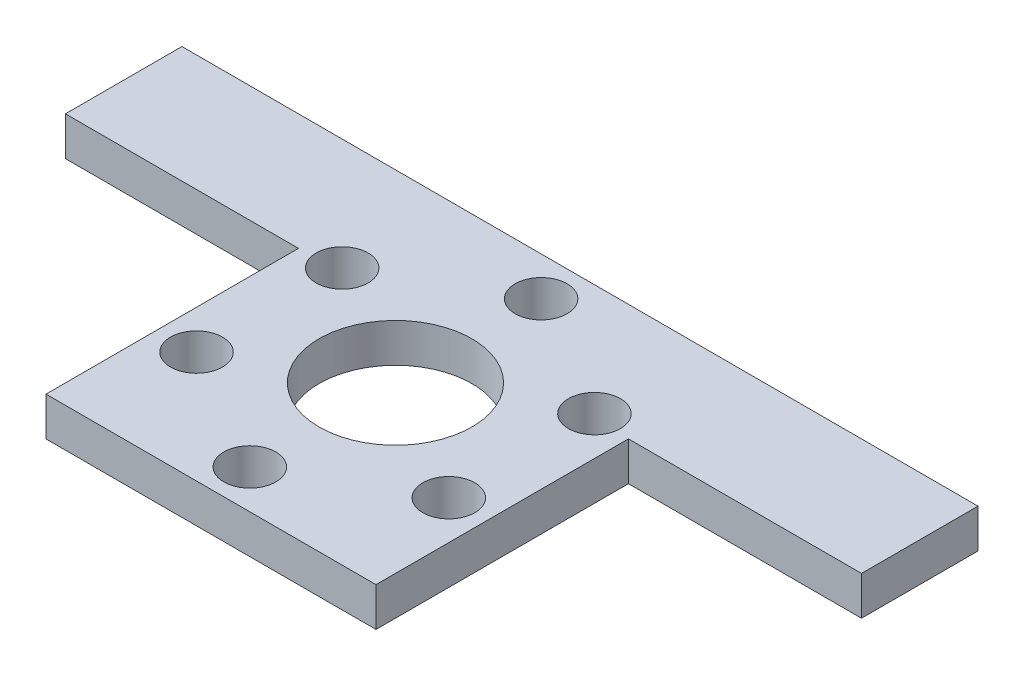
from build123d import *

# Parameters (mm, degrees)
SKETCH1_R            = 5
BOSS_EXTRUDE1_DEPTH  = 2.54
M3_CLEARANCE_HOLE1_D = 3.4


with BuildPart() as part:
    # Sketch1 → Boss-Extrude1 (new body)
    with BuildSketch(Plane(origin=(0, 0, 0), x_dir=(1, 0, 0), z_dir=(0, 1, 0))):
        Polygon((10.788891971, 4.445), (26.028891971, 4.445), (26.028891971, 12.065), (-26.028891971, 12.065), (-26.028891971, 4.445), (-10.788891971, 4.445), (-10.788891971, -12.065), (10.788891971, -12.065), align=None)
        with Locations(Location((0, 0, 0), (0, 0, 270))):
            Circle(SKETCH1_R, mode=Mode.SUBTRACT)
    extrude(amount=BOSS_EXTRUDE1_DEPTH)

    # M3 Clearance Hole1 (through all)
    with Locations(Plane(origin=(0, 2.54, 0), x_dir=(1, 0, 0), z_dir=(0, 1, 0))):
        with Locations((0, 9.525), (8.248891971, 4.7625), (8.248891971, -4.7625), (0, -9.525), (-8.248891971, -4.7625), (-8.248891971, 4.7625)):
            Hole(M3_CLEARANCE_HOLE1_D / 2)


solid = part.part
